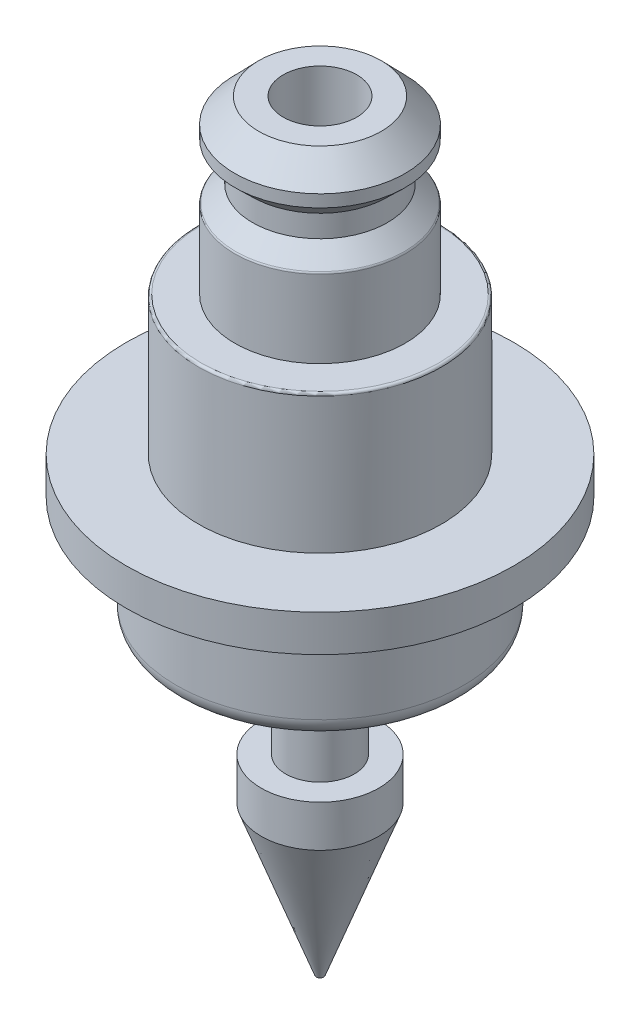
from build123d import *

# Parameters (mm, degrees)
FILLET1_R = 0.75
FILLET2_R = 0.1


with BuildPart() as part:
    # Sketch1 → Revolve1 (revolve)
    with BuildSketch(Plane.XY, mode=Mode.PRIVATE) as revolve1_sk:
        Polygon((1.5, 14.15), (2.5, 14.15), (3.475, 13.15), (3.475, 12.65), (2.75, 11.95), (2.75, 11.05), (3.475, 10.35), (3.475, 7.15), (4.955, 7.15), (4.955, 1.5), (7.9, 1.5), (7.9, 0), (5.85, 0), (5.85, -4.5), (1.4, -4.5), (1.4, -9.1), (2.4, -9.1), (2.4, -10.8), (0.15, -16.9), (0.15, 0), (1.5, 0), align=None)
    revolve(revolve1_sk.sketch.rotate(Axis((0, 0, 0), (0, 1, 0)), 90), axis=Axis((0, 0, 0), (0, 1, 0)))

    # Fillet1
    fillet1_edges = [part.edges().sort_by_distance(p)[0] for p in [
        (0, -4.5, 5.85),
    ]]
    fillet(fillet1_edges, radius=FILLET1_R)

    # Fillet2
    fillet2_edges = [part.edges().sort_by_distance(p)[0] for p in [
        (0, 7.15, 4.955),
        (0, 10.35, 3.475),
    ]]
    fillet(fillet2_edges, radius=FILLET2_R)


solid = part.part
